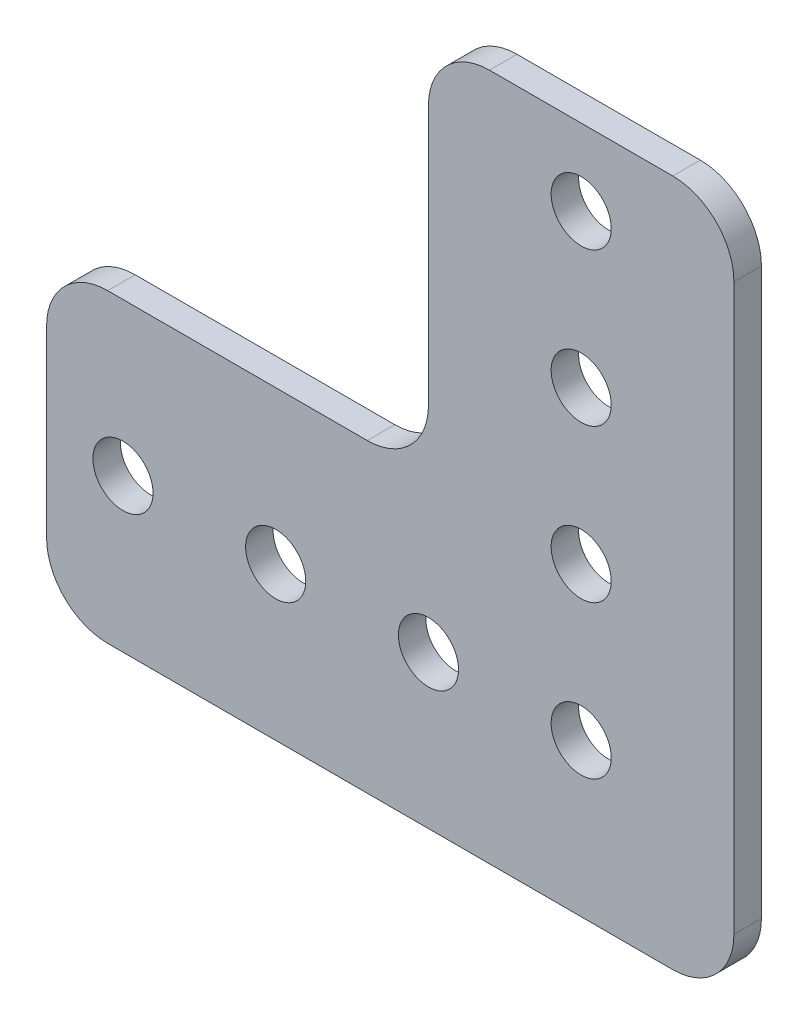
from build123d import *

# Parameters (mm, degrees)
SKETCH1_R           = 2.5
BOSS_EXTRUDE1_DEPTH = 2.286


with BuildPart() as part:
    # Sketch1 → Boss-Extrude1 (new body)
    with BuildSketch(Plane.XY):
        with BuildLine():
            Line((7.62, 577.85), (-7.62, 577.85))
            ThreePointArc((-7.62, 577.85), (-11.212102448, 576.362102448), (-12.7, 572.77))
            Line((-12.7, 572.77), (-12.7, 551.18))
            ThreePointArc((-12.7, 551.18), (-14.187897552, 547.587897552), (-17.78, 546.1))
            Line((-17.78, 546.1), (-39.37, 546.1))
            ThreePointArc((-39.37, 546.1), (-42.962102448, 544.612102448), (-44.45, 541.02))
            Line((-44.45, 541.02), (-44.45, 525.78))
            ThreePointArc((-44.45, 525.78), (-42.962102448, 522.187897552), (-39.37, 520.7))
            Line((-39.37, 520.7), (7.62, 520.7))
            ThreePointArc((7.62, 520.7), (11.212102448, 522.187897552), (12.7, 525.78))
            Line((12.7, 525.78), (12.7, 572.77))
            ThreePointArc((12.7, 572.77), (11.212102448, 576.362102448), (7.62, 577.85))
        make_face()
        with Locations((0, 533.4)):
            Circle(SKETCH1_R, mode=Mode.SUBTRACT)
        with Locations((-12.7, 533.4)):
            Circle(SKETCH1_R, mode=Mode.SUBTRACT)
        with Locations((-25.4, 533.4)):
            Circle(SKETCH1_R, mode=Mode.SUBTRACT)
        with Locations((-38.1, 533.4)):
            Circle(SKETCH1_R, mode=Mode.SUBTRACT)
        with Locations((0, 546.1)):
            Circle(SKETCH1_R, mode=Mode.SUBTRACT)
        with Locations((0, 558.8)):
            Circle(SKETCH1_R, mode=Mode.SUBTRACT)
        with Locations((0, 571.5)):
            Circle(SKETCH1_R, mode=Mode.SUBTRACT)
    extrude(amount=BOSS_EXTRUDE1_DEPTH)


solid = part.part
